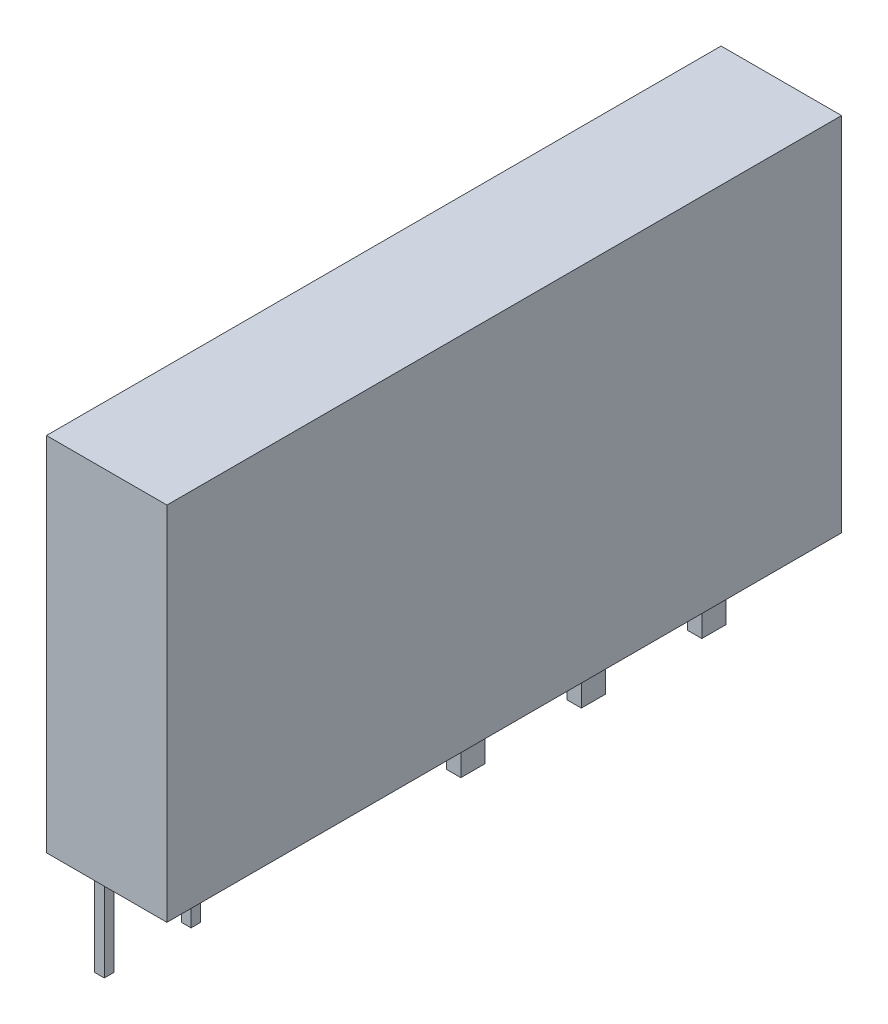
from build123d import *

# Parameters (mm, degrees)
SKETCH1_W           = 28
SKETCH1_H           = 15
BOSS_EXTRUDE1_DEPTH = 5
SKETCH2_W           = 0.4
SKETCH2_H           = 0.4
SKETCH2_W_2         = 0.6
SKETCH2_H_2         = 1
BOSS_EXTRUDE2_DEPTH = 4.3


with BuildPart() as part:
    # Sketch1 → Boss-Extrude1 (new body)
    with BuildSketch(Plane(origin=(0, 0, 0), x_dir=(0, 0, -1), z_dir=(1, 0, 0))):
        with Locations((14, 7.5)):
            Rectangle(SKETCH1_W, SKETCH1_H)
    extrude(amount=BOSS_EXTRUDE1_DEPTH)

    # Sketch2 → Boss-Extrude2 (add)
    with BuildSketch(Plane.XZ):
        with Locations((1.2, -1.2)):
            Rectangle(SKETCH2_W, SKETCH2_H)
        with Locations((1.2, -4.8)):
            Rectangle(SKETCH2_W, SKETCH2_H)
        with Locations((1.3, -26.1)):
            Rectangle(SKETCH2_W_2, SKETCH2_H_2)
        with Locations((1.3, -21.1)):
            Rectangle(SKETCH2_W_2, SKETCH2_H_2)
        with Locations((1.3, -16.1)):
            Rectangle(SKETCH2_W_2, SKETCH2_H_2)
    extrude(amount=BOSS_EXTRUDE2_DEPTH)


solid = part.part
